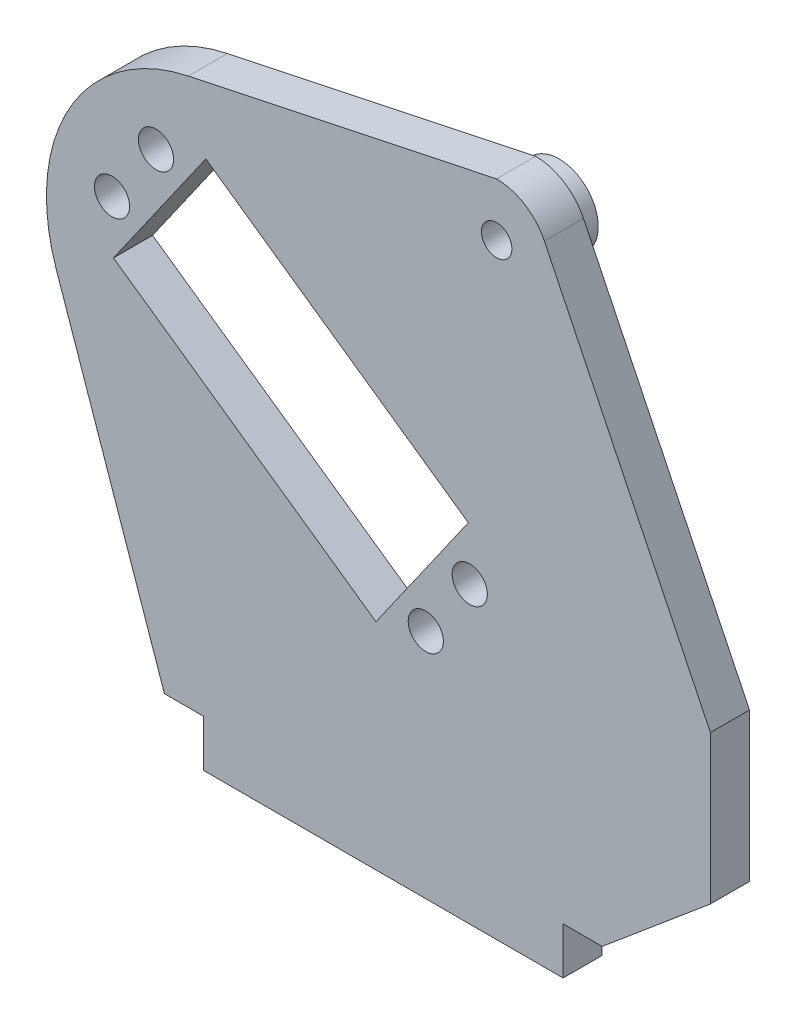
from build123d import *

# Parameters (mm, degrees)
SKETCH1_R                  = 2.25
BOSS_EXTRUDE1_DEPTH        = 5
M3_5_CLEARANCE_HOLE1_D     = 3.9
M3_5_CLEARANCE_HOLE1_DEPTH = 10
M3_5_CLEARANCE_HOLE1_TIP   = 1.171678207
EXTRUDE_START              = 3
SKETCH_2_R                 = 5
SKETCH_2_R_2               = 1.95
EXTRUDE_2_DEPTH            = 3


with BuildPart() as part:
    # Sketch1 → Boss-Extrude1 (new body)
    with BuildSketch(Plane.XY):
        with BuildLine():
            Line((41.849999868, 40.621529794), (20.610605728, 84.460506241))
            ThreePointArc((20.610605728, 84.460506241), (18.105708126, 87.253517924), (14.499999983, 88.289999977))
            Line((14.499999983, 88.289999977), (-24.945583467, 79.961565754))
            ThreePointArc((-24.945583467, 79.961565754), (-40.125494586, 68.851065128), (-41.843761596, 50.118193373))
            Line((-41.843761596, 50.118193373), (-27.999999977, 9.999999991))
            Line((-27.999999977, 9.999999991), (-22.999999995, 9.999999991))
            Line((-22.999999995, 9.999999991), (-22.999999995, 3.999999991))
            Line((-22.999999995, 3.999999991), (22.999999995, 3.999999991))
            Line((22.999999995, 3.999999991), (22.999999995, 9.999999991))
            Line((22.999999995, 9.999999991), (27.999999977, 9.999999991))
            Line((27.999999977, 9.999999991), (41.849999868, 21.621529803))
            Line((41.849999868, 21.621529803), (41.849999868, 40.621529794))
        make_face()
        with Locations((-29.082392063, 69.767309235)):
            Circle(SKETCH1_R, mode=Mode.SUBTRACT)
        with Locations((-34.70344114, 61.739619201)):
            Circle(SKETCH1_R, mode=Mode.SUBTRACT)
        with Locations(Location((5.43500903, 33.63437382, 0), (0, 0, 180))):
            Circle(SKETCH1_R, mode=Mode.SUBTRACT)
        with Locations(Location((11.056058107, 41.662063854, 0), (0, 0, 180))):
            Circle(SKETCH1_R, mode=Mode.SUBTRACT)
        Polygon((-22.70847113, 71.896424529), (-34.524145719, 55.021892416), (-0.938911903, 31.505258526), (10.876762686, 48.379790638), align=None, mode=Mode.SUBTRACT)
    extrude(amount=-BOSS_EXTRUDE1_DEPTH)

    # M3.5 Clearance Hole1
    with Locations(Plane.XY):
        with Locations((14.499999983, 81.499999989)):
            Hole(M3_5_CLEARANCE_HOLE1_D / 2, depth=M3_5_CLEARANCE_HOLE1_DEPTH)
            with Locations((0, 0, -(M3_5_CLEARANCE_HOLE1_DEPTH + M3_5_CLEARANCE_HOLE1_TIP / 2))):  # 118° drill point
                Cone(0, M3_5_CLEARANCE_HOLE1_D / 2, M3_5_CLEARANCE_HOLE1_TIP, mode=Mode.SUBTRACT)

    # 草图2 → 凸台-拉伸2 (add)
    with BuildSketch(Plane(origin=(0, 0, -5), x_dir=(-1, 0, 0), z_dir=(0, 0, -1)).offset(EXTRUDE_START)):
        with Locations(Location((-14.499999983, 81.499999989, 0), (0, 0, 180))):
            Circle(SKETCH_2_R)
        with Locations(Location((-14.499999983, 81.499999989, 0), (0, 0, 180))):
            Circle(SKETCH_2_R_2, mode=Mode.SUBTRACT)
    extrude(amount=-EXTRUDE_2_DEPTH)


solid = part.part
